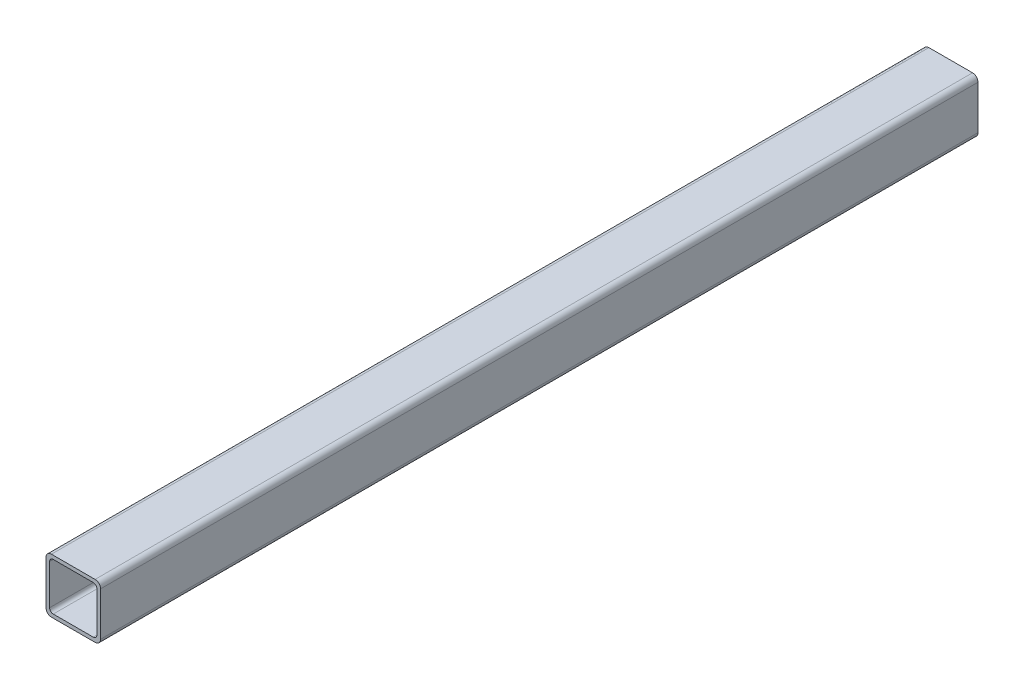
from build123d import *

# Parameters (mm, degrees)
EXTRUDE_1_DEPTH = 482.5


with BuildPart() as part:
    # Эскиз1 → Бобышка-Вытянуть1 (new body)
    with BuildSketch(Plane.XY):
        with BuildLine():
            Line((-27, 0), (-3, 0))
            ThreePointArc((-3, 0), (-0.878679656, -0.878679656), (0, -3))
            Line((0, -3), (0, -27))
            ThreePointArc((0, -27), (-0.878679656, -29.121320344), (-3, -30))
            Line((-3, -30), (-27, -30))
            ThreePointArc((-27, -30), (-29.121320344, -29.121320344), (-30, -27))
            Line((-30, -27), (-30, -3))
            ThreePointArc((-30, -3), (-29.121320344, -0.878679656), (-27, 0))
        make_face()
        with BuildLine():
            Line((-26, -2), (-4, -2))
            ThreePointArc((-4, -2), (-2.585786438, -2.585786438), (-2, -4))
            Line((-2, -4), (-2, -26))
            ThreePointArc((-2, -26), (-2.585786438, -27.414213562), (-4, -28))
            Line((-4, -28), (-26, -28))
            ThreePointArc((-26, -28), (-27.414213562, -27.414213562), (-28, -26))
            Line((-28, -26), (-28, -4))
            ThreePointArc((-28, -4), (-27.414213562, -2.585786438), (-26, -2))
        make_face(mode=Mode.SUBTRACT)
    extrude(amount=-EXTRUDE_1_DEPTH)


solid = part.part
